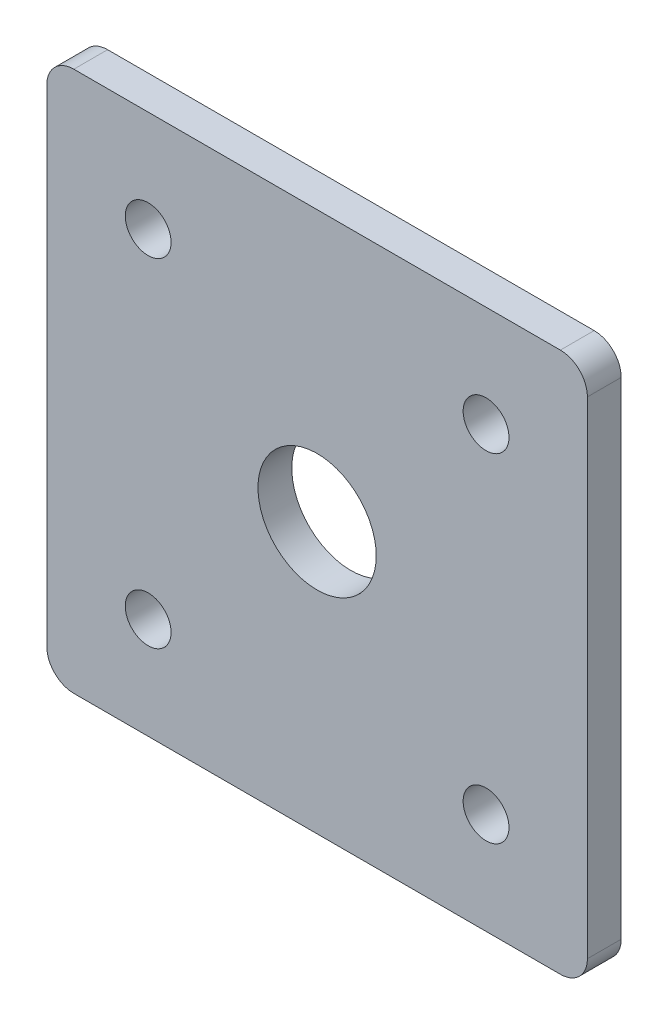
from build123d import *

# Parameters (mm, degrees)
SKETCH1_W             = 50.8
SKETCH1_H             = 50.8
SKETCH1_R             = 5.55625
BOSS_EXTRUDE1_DEPTH   = 1.5875
F_8_CLEARANCE_HOLE1_D = 4.3053
FILLET1_R             = 2.54


with BuildPart() as part:
    # Sketch1 → Boss-Extrude1 (new, symmetric)
    with BuildSketch(Plane.XY):
        Rectangle(SKETCH1_W, SKETCH1_H)
        Circle(SKETCH1_R, mode=Mode.SUBTRACT)
    extrude(amount=BOSS_EXTRUDE1_DEPTH, both=True)

    # #8 Clearance Hole1 (through all)
    with Locations(Plane.XY.offset(1.5875)):
        with Locations((-15.875, 15.875), (15.875, 15.875), (15.875, -15.875), (-15.875, -15.875), (0, 0)):
            Hole(F_8_CLEARANCE_HOLE1_D / 2)

    # Fillet1
    fillet1_edges = [part.edges().sort_by_distance(p)[0] for p in [
        (25.4, -25.4, 0),
        (-25.4, -25.4, 0),
        (-25.4, 25.4, 0),
        (25.4, 25.4, 0),
    ]]
    fillet(fillet1_edges, radius=FILLET1_R)


solid = part.part
